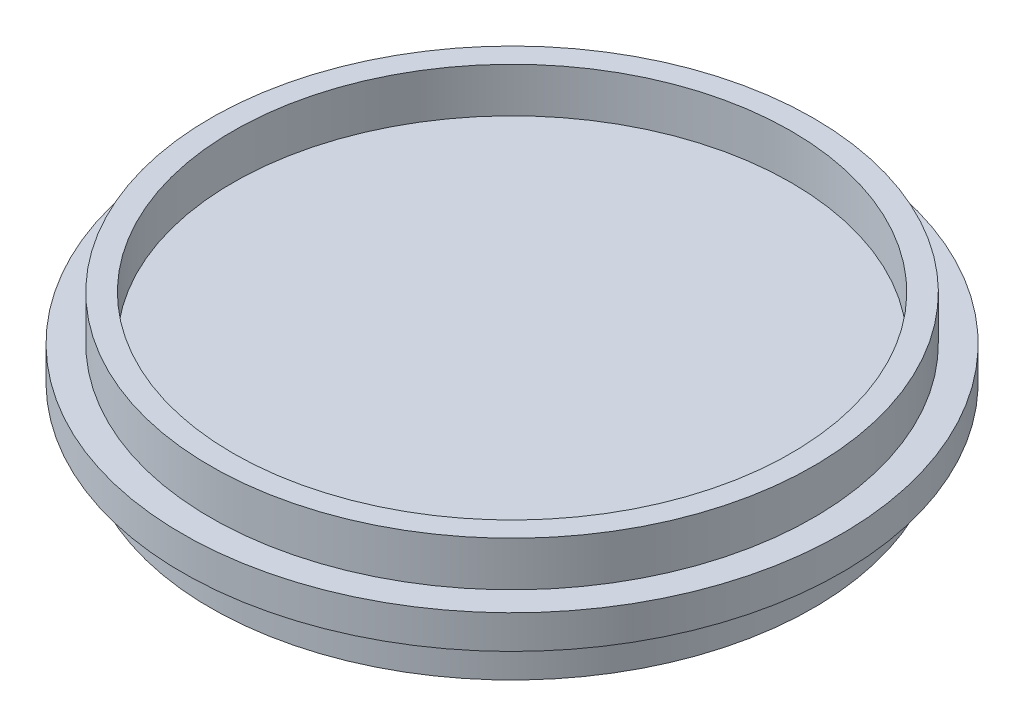
from build123d import *

# Parameters (mm, degrees)
SKETCH1_W           = 127.635
SKETCH1_H           = 127.635
BOSS_EXTRUDE1_DEPTH = 9.525
SKETCH12_R          = 93.726
BOSS_EXTRUDE2_DEPTH = 9.525
SKETCH30_R          = 85.725
SKETCH30_R_2        = 79.375
BOSS_EXTRUDE3_DEPTH = 12.7


with BuildPart() as part:
    # Sketch1 → Boss-Extrude1 (new body)
    with BuildSketch(Plane(origin=(0, 0, 0), x_dir=(1, 0, 0), z_dir=(0, 1, 0))):
        with Locations((63.8175, 63.8175)):
            Rectangle(SKETCH1_W, SKETCH1_H)
    extrude(amount=BOSS_EXTRUDE1_DEPTH)

    # Sketch12 → Boss-Extrude2 (add)
    with BuildSketch(Plane.XZ):
        with Locations(Location((63.8175, -63.8175, 0), (0, 0, 270))):
            Circle(SKETCH12_R)
    extrude(amount=-BOSS_EXTRUDE2_DEPTH)

    # Sketch30 → Boss-Extrude3 (add)
    with BuildSketch(Plane.XZ):
        with Locations(Location((63.8175, -63.8175, 0), (0, 0, 270))):
            Circle(SKETCH30_R)
        with Locations(Location((63.8175, -63.8175, 0), (0, 0, 270))):
            Circle(SKETCH30_R_2, mode=Mode.SUBTRACT)
    boss_extrude3 = extrude(amount=BOSS_EXTRUDE3_DEPTH)

    # Mirror1: Boss-Extrude3 across plane
    add(boss_extrude3.mirror(Plane.ZX.offset(4.7625)))


solid = part.part
